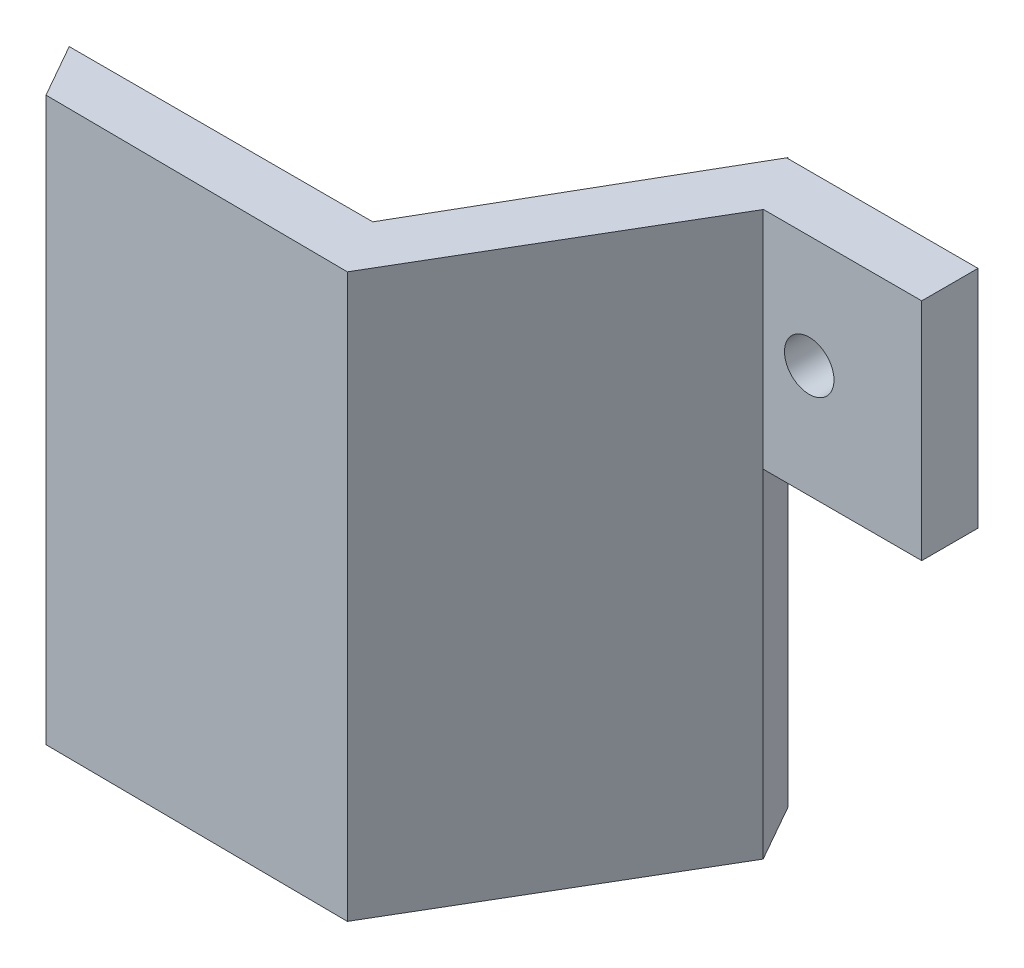
from build123d import *

# Parameters (mm, degrees)
ESQUISSE3_W             = 20
ESQUISSE3_H             = 20
BOSS_EXTRU_2_DEPTH      = 5
ESQUISSE5_R             = 2.2
ENL_V_MAT_EXTRU_2_DEPTH = 5
BOSS_EXTRU_4_DEPTH      = 1
BOSS_EXTRU_4_DEPTH_BACK = 50
ENL_V_MAT_EXTRU_3_DEPTH = 52
ESQUISSE17_W            = 44.772761967
ESQUISSE17_H            = 32.67201549
ENL_V_MAT_EXTRU_4_DEPTH = 1


with BuildPart() as part:
    # Esquisse3 → Boss.-Extru.2 (new body)
    with BuildSketch(Plane.XY):
        with Locations((0.833384448, -1.552723646)):
            Rectangle(ESQUISSE3_W, ESQUISSE3_H)
    extrude(amount=BOSS_EXTRU_2_DEPTH)

    # Esquisse5 → Enlèv. mat.-Extru.2 (cut)
    with BuildSketch(Plane.XY.offset(5)):
        with Locations((0.833384448, -1.552723646)):
            Circle(ESQUISSE5_R)
    extrude(amount=-ENL_V_MAT_EXTRU_2_DEPTH, mode=Mode.SUBTRACT)

    # Esquisse15 → Boss.-Extru.4 (add, two sides: drawn at the far end of the back side and taken through both)
    with BuildSketch(Plane(origin=(0, 8.447276354, 0), x_dir=(1, 0, 0), z_dir=(0, 1, 0)).offset(-BOSS_EXTRU_4_DEPTH_BACK)):
        Polygon((-16.923746628, -28.293399859), (-3.242841841, -5.019846719), (-16.557877703, 18.464940943), (-43.553818352, 18.676175465), (-57.234723139, -4.597377675), (-43.919687277, -28.082165337), align=None)
    extrude(amount=BOSS_EXTRU_4_DEPTH + BOSS_EXTRU_4_DEPTH_BACK)

    # Esquisse16 → Enlèv. mat.-Extru.3 (cut)
    with BuildSketch(Plane(origin=(0, 9.447276354, 0), x_dir=(1, 0, 0), z_dir=(0, 1, 0))):
        Polygon((-3.971698256, 3.828685124), (-19.643043748, 30.972251739), (-50.985734731, 30.972251739), (-66.657080223, 3.828685124), (-50.985734731, -23.314881491), (-19.643043748, -23.314881491), align=None)
    extrude(amount=-ENL_V_MAT_EXTRU_3_DEPTH, mode=Mode.SUBTRACT)

    # Esquisse17 → Enlèv. mat.-Extru.4 (cut)
    with BuildSketch(Plane(origin=(0, 9.447276354, 0), x_dir=(1, 0, 0), z_dir=(0, 1, 0))):
        with Locations((-25.155039142, -14.317707157)):
            Rectangle(ESQUISSE17_W, ESQUISSE17_H)
    extrude(amount=-ENL_V_MAT_EXTRU_4_DEPTH, mode=Mode.SUBTRACT)


solid = part.part
